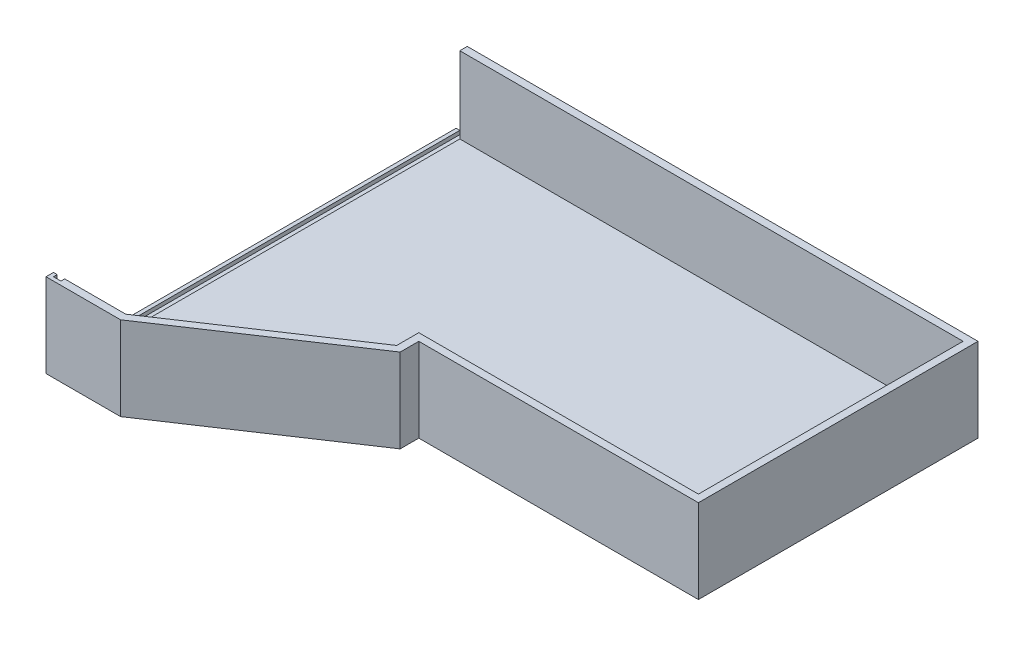
from build123d import *

# Parameters (mm, degrees)
BOSS_EXTRUDE1_DEPTH = 22.5
CUT_EXTRUDE5_DEPTH  = 20.5
SKETCH11_W          = 106
SKETCH11_H          = 20.5
CUT_EXTRUDE6_DEPTH  = 20.5
SKETCH12_W          = 3
SKETCH12_H          = 20.5
CUT_EXTRUDE7_DEPTH  = 20.5
SKETCH13_W          = 2
SKETCH13_H          = 108
CUT_EXTRUDE8_DEPTH  = 1
SKETCH14_W          = 2
SKETCH14_H          = 21.5
CUT_EXTRUDE9_DEPTH  = 1


with BuildPart() as part:
    # ff → Boss-Extrude1 (new body)
    with BuildSketch(Plane(origin=(0, 0, 0), x_dir=(1, 0, 0), z_dir=(0, 1, 0))):
        Polygon((0, -75), (0, 0), (-140, 0), (-140, -110), (-120, -110), (-75, -80), (-75, -75), align=None)
    extrude(amount=BOSS_EXTRUDE1_DEPTH)

    # Sketch2 → Cut-Extrude5 (cut)
    with BuildSketch(Plane(origin=(0, 22.5, 0), x_dir=(1, 0, 0), z_dir=(0, 1, 0))):
        Polygon((-77, -78.929632483), (-77, -73), (-2, -73), (-2, -2), (-138, -2), (-138, -108), (-120.605551275, -108), align=None)
    extrude(amount=-CUT_EXTRUDE5_DEPTH, mode=Mode.SUBTRACT)

    # Sketch11 → Cut-Extrude6 (cut)
    with BuildSketch(Plane(origin=(-138, 0, 0), x_dir=(0, 0, -1), z_dir=(1, 0, 0))):
        with Locations((-55, 12.25)):
            Rectangle(SKETCH11_W, SKETCH11_H)
    extrude(amount=-CUT_EXTRUDE6_DEPTH, mode=Mode.SUBTRACT)

    # Sketch12 → Cut-Extrude7 (cut)
    with BuildSketch(Plane.XY.offset(2)):
        with Locations((-138.5, 12.25)):
            Rectangle(SKETCH12_W, SKETCH12_H)
    extrude(amount=-CUT_EXTRUDE7_DEPTH, mode=Mode.SUBTRACT)

    # Sketch13 → Cut-Extrude8 (cut)
    with BuildSketch(Plane(origin=(0, 2, 0), x_dir=(1, 0, 0), z_dir=(0, 1, 0))):
        with Locations((-138, -54)):
            Rectangle(SKETCH13_W, SKETCH13_H)
    extrude(amount=-CUT_EXTRUDE8_DEPTH, mode=Mode.SUBTRACT)

    # Sketch14 → Cut-Extrude9 (cut)
    with BuildSketch(Plane(origin=(0, 0, 108), x_dir=(-1, 0, 0), z_dir=(0, 0, -1))):
        with Locations((138, 11.75)):
            Rectangle(SKETCH14_W, SKETCH14_H)
    extrude(amount=-CUT_EXTRUDE9_DEPTH, mode=Mode.SUBTRACT)


solid = part.part
